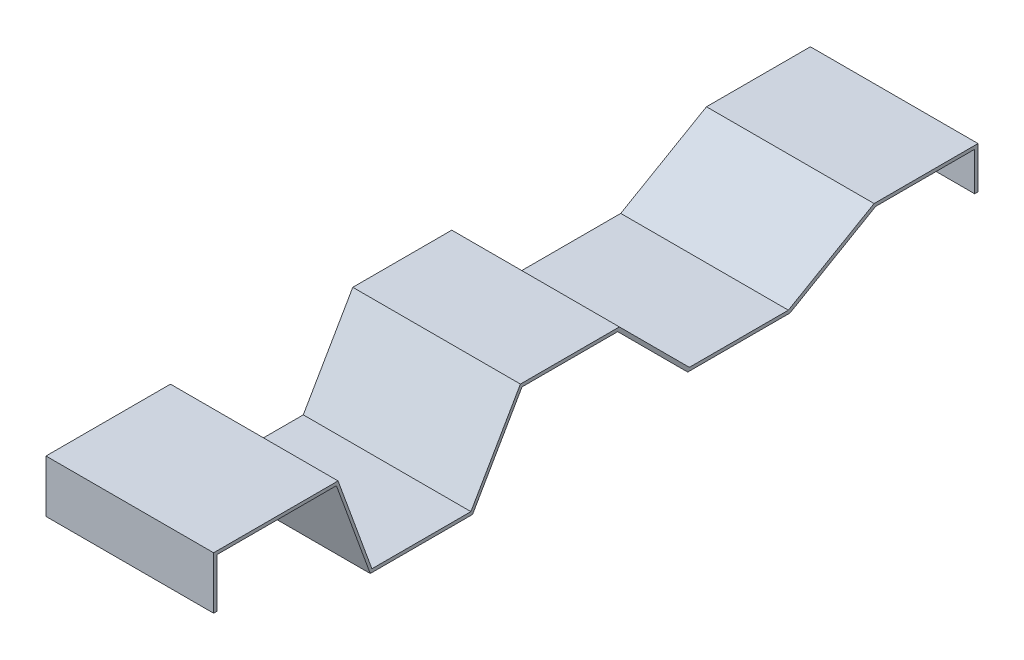
from build123d import *

# Parameters (mm, degrees)
BOSS_EXTRUDE1_DEPTH = 101.6


with BuildPart() as part:
    # Sketch1 → Boss-Extrude1 (new body)
    with BuildSketch(Plane(origin=(0, 0, 0), x_dir=(0, 0, -1), z_dir=(1, 0, 0))):
        Polygon((410.975974775, -727.738016425), (410.975974775, -702.338016425), (347.983974775, -702.338016425), (296.022450548, -732.338016425), (236.022450548, -732.338016425), (193.596043677, -689.911609554), (133.596043677, -689.911609554), (103.596043677, -741.873133781), (43.596043677, -741.873133781), (23.074835078, -685.491576534), (-52.363164922, -685.491576534), (-52.363164922, -717.241576534), (-50.363164922, -717.241576534), (-50.363164922, -687.491576534), (22.066835078, -687.491576534), (42.588043677, -743.873133781), (104.588043677, -743.873133781), (134.588043677, -691.911609554), (192.588043677, -691.911609554), (235.014450548, -734.338016425), (297.014450548, -734.338016425), (348.975974775, -704.338016425), (408.975974775, -704.338016425), (408.975974775, -727.738016425), align=None)
    extrude(amount=BOSS_EXTRUDE1_DEPTH)


solid = part.part
